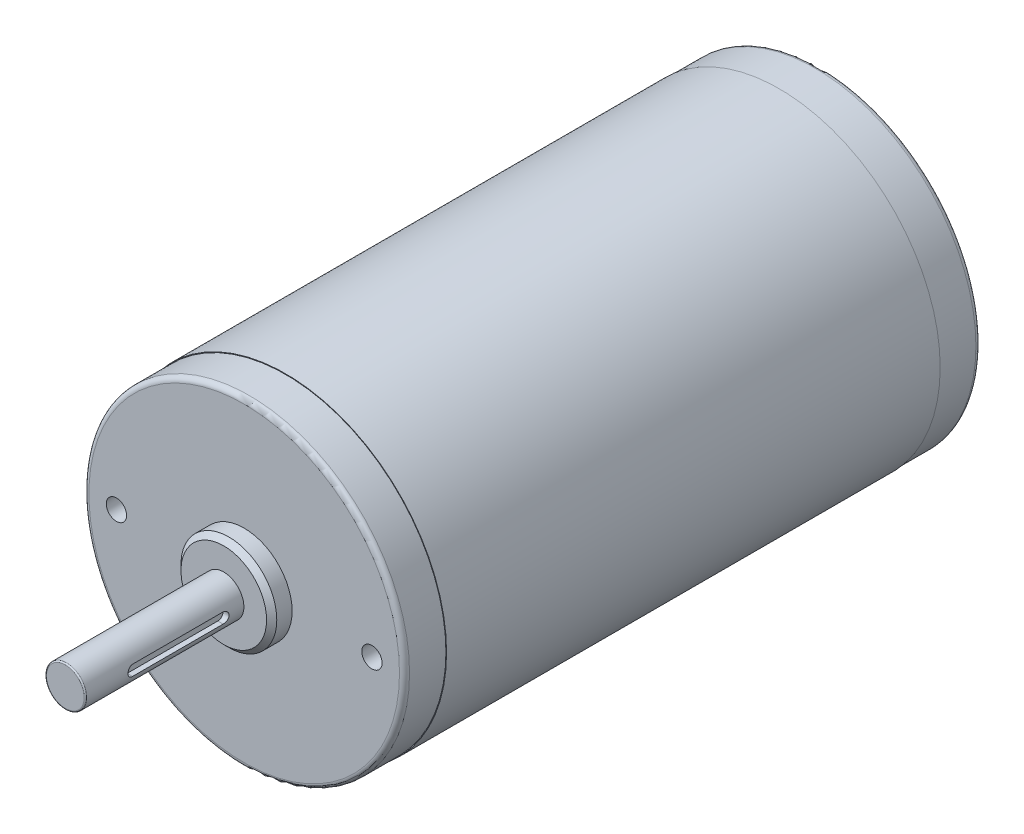
from build123d import *

# Parameters (mm, degrees)
SKETCH1_W                       = 32.004
SKETCH1_H                       = 98.1456
SKETCH2_R                       = 31.877
BOSS_EXTRUDE1_DEPTH             = 8.2296
SKETCH3_R                       = 15.0368
BOSS_EXTRUDE2_DEPTH             = 4.7625
BOSS_EXTRUDE3_START             = 8.2296
SKETCH4_R                       = 31.877
BOSS_EXTRUDE3_DEPTH             = 8.2296
SKETCH5_R                       = 9.525
BOSS_EXTRUDE4_DEPTH             = 4.064
SKETCH6_R                       = 4
BOSS_EXTRUDE5_DEPTH             = 31.5
CUT_EXTRUDE1_REACH              = 178.75
CUT_EXTRUDE1_END_RADIUS         = 4
F_21_0_159_DIAMETER_HOLE1_D     = 4.0386
F_21_0_159_DIAMETER_HOLE1_DEPTH = 13.6144
F_21_0_159_DIAMETER_HOLE1_TIP   = 1.213317848
CHAMFER1_SIZE                   = 1.015999998
CHAMFER1_SIZE2                  = 1.016
FILLET1_R                       = 0.254
FILLET2_R                       = 1


with BuildPart() as part:
    # Sketch1 → Revolve1 (revolve)
    with BuildSketch(Plane.XZ.offset(-109.2962), mode=Mode.PRIVATE) as revolve1_sk:
        with Locations((51.562, -38.2524)):
            Rectangle(SKETCH1_W, SKETCH1_H)
    revolve(revolve1_sk.sketch.rotate(Axis((35.56, 109.2962, 10.8204), (0, 0, -1)), 180), axis=Axis((35.56, 109.2962, 10.8204), (0, 0, -1)))

    # Sketch2 → Boss-Extrude1 (add)
    with BuildSketch(Plane(origin=(0, 0, -87.3252), x_dir=(-1, 0, 0), z_dir=(0, 0, -1))):
        with Locations((-35.56, 109.2962)):
            Circle(SKETCH2_R)
    extrude(amount=BOSS_EXTRUDE1_DEPTH)

    # Sketch3 → Boss-Extrude2 (add)
    with BuildSketch(Plane(origin=(0, 0, -95.5548), x_dir=(-1, 0, 0), z_dir=(0, 0, -1))):
        with Locations((-35.56, 109.2962)):
            Circle(SKETCH3_R)
    extrude(amount=BOSS_EXTRUDE2_DEPTH)

    # Sketch4 → Boss-Extrude3 (add)
    with BuildSketch(Plane.XY.offset(10.8204).offset(BOSS_EXTRUDE3_START)):
        with Locations(Location((35.56, 109.2962, 0), (0, 0, 180))):
            Circle(SKETCH4_R)
    extrude(amount=-BOSS_EXTRUDE3_DEPTH)

    # Sketch5 → Boss-Extrude4 (add)
    with BuildSketch(Plane.XY.offset(19.05)):
        with Locations((35.56, 109.2962)):
            Circle(SKETCH5_R)
    extrude(amount=BOSS_EXTRUDE4_DEPTH)

    # Sketch6 → Boss-Extrude5 (add)
    with BuildSketch(Plane.XY.offset(23.114)):
        with Locations((35.56, 109.2962)):
            Circle(SKETCH6_R)
    extrude(amount=BOSS_EXTRUDE5_DEPTH)

    # Cut-Extrude1: up to this cylinder (the profile starts inside it)
    cut_extrude1_end = Plane(origin=(35.56, 109.2962, 36.1), z_dir=(0, 0, -1)) * Cylinder(CUT_EXTRUDE1_END_RADIUS, 366.5, mode=Mode.PRIVATE)
    # Sketch7 → Cut-Extrude1 (cut, up to the surface)
    with BuildSketch(Plane(origin=(38.36, 0, 0), x_dir=(0, -1, 0), z_dir=(-1, 0, 0)), mode=Mode.PRIVATE) as cut_extrude1_sk1:
        with BuildLine():
            Line((-108.2462, 27.1), (-108.2462, 45.1))
            ThreePointArc((-108.2462, 45.1), (-109.2962, 46.15), (-110.3462, 45.1))
            Line((-110.3462, 45.1), (-110.3462, 27.1))
            ThreePointArc((-110.3462, 27.1), (-109.2962, 26.05), (-108.2462, 27.1))
        make_face()
    cut_extrude1_tool1 = extrude(cut_extrude1_sk1.sketch, amount=-CUT_EXTRUDE1_REACH, mode=Mode.PRIVATE) & cut_extrude1_end
    add(cut_extrude1_tool1.solids().sort_by_distance((38.36, 109.2962, 36.1))[0], mode=Mode.SUBTRACT)

    # Sketch8 → Revolve2 (revolve)
    with BuildSketch(Plane.XZ.offset(-120.503559639), mode=Mode.PRIVATE) as revolve2_sk:
        Polygon((58.485090683, -95.5548), (54.167090681, -95.5548), (54.167090681, -97.802699998), (56.285090681, -97.802699998), (58.485090683, -95.602699996), align=None)
    revolve(revolve2_sk.sketch.rotate(Axis((54.167090681, 120.503559639, -95.5548), (0, 0, -1)), 180), axis=Axis((54.167090681, 120.503559639, -95.5548), (0, 0, -1)))

    # Sketch9 → Revolve3 (revolve)
    with BuildSketch(Plane.XZ.offset(-127.903290683), mode=Mode.PRIVATE) as revolve3_sk:
        Polygon((51.085359639, -95.5548), (46.767359637, -95.5548), (46.767359637, -97.802699998), (48.885359637, -97.802699998), (51.085359639, -95.602699996), align=None)
    revolve(revolve3_sk.sketch.rotate(Axis((46.767359637, 127.903290683, -95.5548), (0, 0, -1)), 180), axis=Axis((46.767359637, 127.903290683, -95.5548), (0, 0, -1)))

    # #21 (0.159) Diameter Hole1
    with Locations(Plane.XY.offset(19.05)):
        with Locations((10.16, 109.2962), (60.96, 109.2962)):
            Hole(F_21_0_159_DIAMETER_HOLE1_D / 2, depth=F_21_0_159_DIAMETER_HOLE1_DEPTH)
            with Locations((0, 0, -(F_21_0_159_DIAMETER_HOLE1_DEPTH + F_21_0_159_DIAMETER_HOLE1_TIP / 2))):  # 118° drill point
                Cone(0, F_21_0_159_DIAMETER_HOLE1_D / 2, F_21_0_159_DIAMETER_HOLE1_TIP, mode=Mode.SUBTRACT)

    # Chamfer1
    chamfer1_edges = [part.edges().sort_by_distance(p)[0] for p in [
        (26.035, 109.2962, 23.114),
    ]]
    chamfer1_side = [part.faces().sort_by_distance(p)[0] for p in [
        (26.035, 109.2962, 21.082),
    ]]
    chamfer(chamfer1_edges, length=CHAMFER1_SIZE, length2=CHAMFER1_SIZE2, reference=chamfer1_side[0])

    # Fillet1
    fillet1_edges = [part.edges().sort_by_distance(p)[0] for p in [
        (31.56, 109.2962, 54.614),
    ]]
    fillet(fillet1_edges, radius=FILLET1_R)

    # Fillet2
    fillet2_edges = [part.edges().sort_by_distance(p)[0] for p in [
        (50.5968, 109.2962, -100.3173),
        (67.437, 109.2962, 19.05),
        (67.437, 109.2962, -95.5548),
    ]]
    fillet(fillet2_edges, radius=FILLET2_R)


solid = part.part
